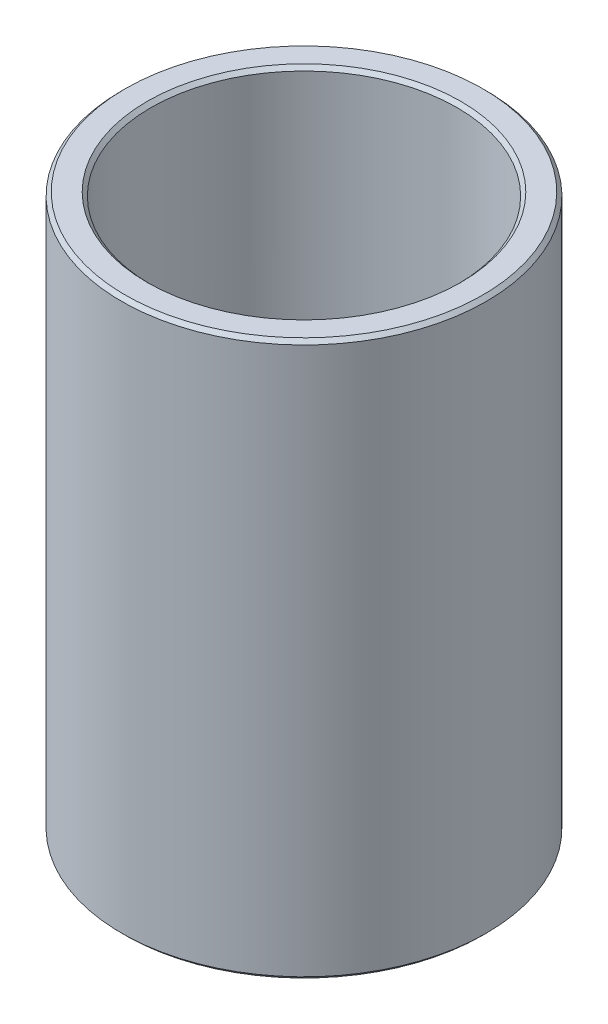
from build123d import *

# Parameters (mm, degrees)
CHAMFER1_SIZE = 0.25


with BuildPart() as part:
    # Sketch1 → Revolve1 (revolve)
    with BuildSketch(Plane.XY):
        Polygon((2, 0), (2, 1), (5, 4), (10.5, 4), (10.5, 38), (12.5, 38), (12.5, 0), align=None)
    revolve(axis=Axis((0, -587.15114798, 0), (0, 1, 0)))

    # Chamfer1
    chamfer1_edges = [part.edges().sort_by_distance(p)[0] for p in [
        (-12.5, 0, 0),
        (-12.5, 38, 0),
        (-10.5, 38, 0),
        (-2, 0, 0),
    ]]
    chamfer(chamfer1_edges, length=CHAMFER1_SIZE)


solid = part.part
